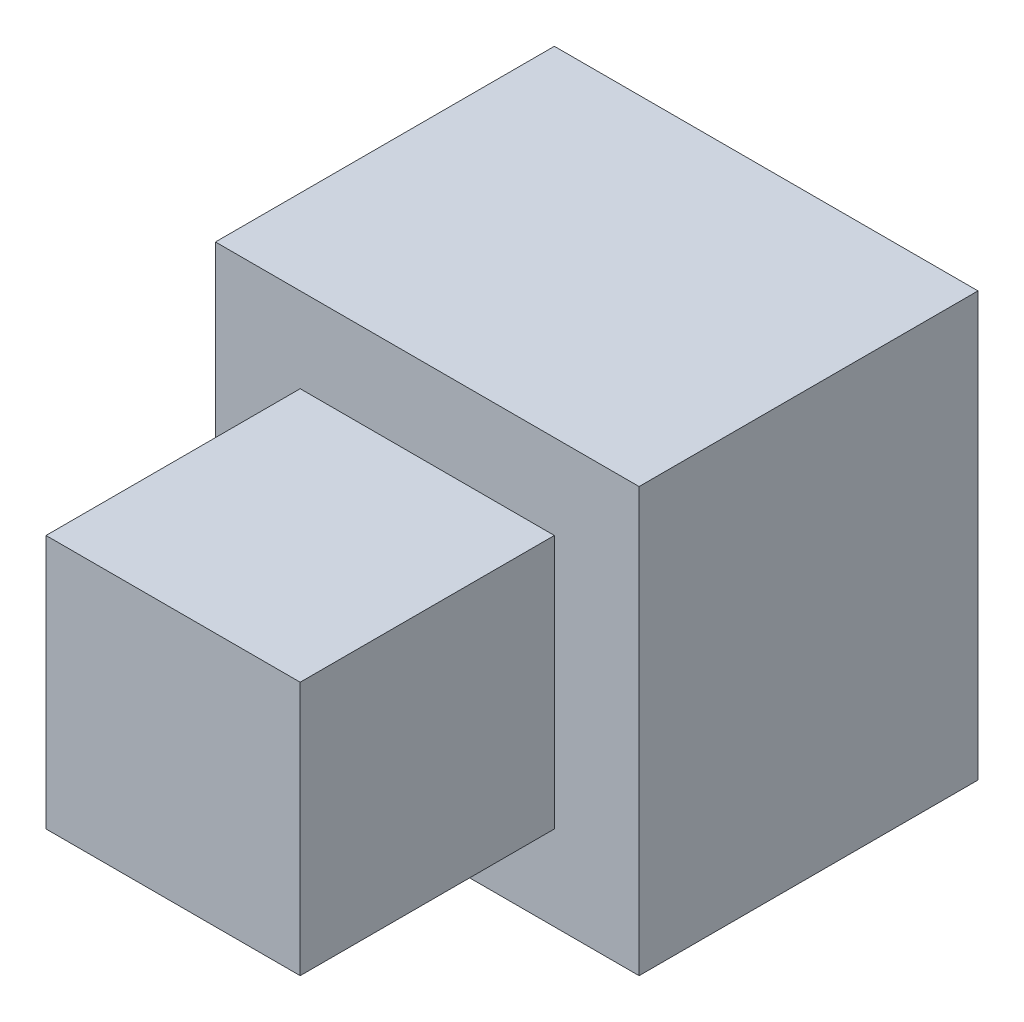
from build123d import *

# Parameters (mm, degrees)
SKETCH_1_W      = 50
SKETCH_1_H      = 50
EXTRUDE_1_DEPTH = 40
SKETCH_2_W      = 30
SKETCH_2_H      = 30
EXTRUDE_2_DEPTH = 30


with BuildPart() as part:
    # 草图1 → 凸台-拉伸1 (new body)
    with BuildSketch(Plane.XY):
        Rectangle(SKETCH_1_W, SKETCH_1_H)
    extrude(amount=EXTRUDE_1_DEPTH)

    # 草图2 → 凸台-拉伸2 (add)
    with BuildSketch(Plane.XY.offset(40)):
        Rectangle(SKETCH_2_W, SKETCH_2_H)
    extrude(amount=EXTRUDE_2_DEPTH)


solid = part.part
